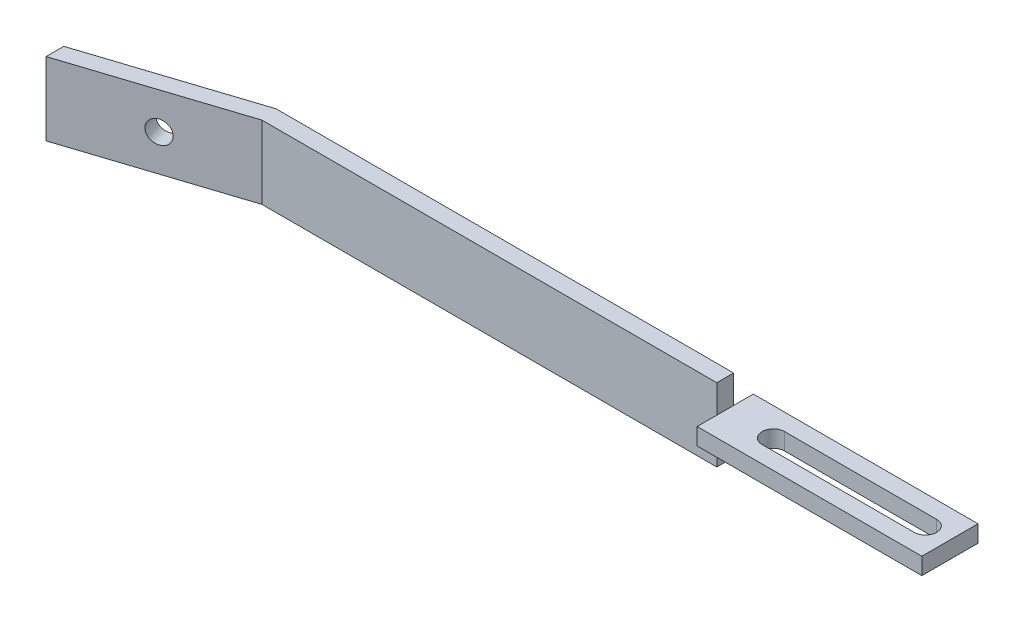
from build123d import *

# Parameters (mm, degrees)
SKETCH1_W               = 150
SKETCH1_H               = 13
BOSS_EXTRUDE1_DEPTH     = 40
CUT_EXTRUDE1_DEPTH      = 40
CUT_EXTRUDE3_DEPTH      = 86.988371307
SKETCH4_W               = 40
SKETCH4_H               = 3
BOSS_EXTRUDE2_DEPTH     = 6.5
CUT_EXTRUDE4_DEPTH      = 76.868825443
CUT_EXTRUDE4_DEPTH_BACK = 76.868825443
SKETCH5_W               = 40
SKETCH5_H               = 5
SKETCH6_W               = 40
SKETCH6_H               = 3
BOSS_EXTRUDE3_DEPTH     = 3.5
CUT_EXTRUDE6_DEPTH      = 6.5
SKETCH8_R               = 2
CUT_EXTRUDE7_DEPTH      = 6.5


with BuildPart() as part:
    # Sketch1 → Boss-Extrude1 (new body)
    with BuildSketch(Plane.XY):
        Rectangle(SKETCH1_W, SKETCH1_H)
    extrude(amount=BOSS_EXTRUDE1_DEPTH)

    # Sketch2 → Cut-Extrude1 (cut)
    with BuildSketch(Plane.XZ.offset(6.5)):
        Polygon((-75, 9.270509831), (-46.468304511, 0), (-75, 0), align=None)
    extrude(amount=-CUT_EXTRUDE1_DEPTH, mode=Mode.SUBTRACT)

    # Sketch3 → Cut-Extrude3 (cut, through all)
    with BuildSketch(Plane.XZ.offset(6.5)):
        Polygon((-75, 12.424896504), (-45.99315119, 3), (75, 3), (75, 40), (-75, 40), align=None)
    extrude(amount=-CUT_EXTRUDE3_DEPTH, mode=Mode.SUBTRACT)

    # Sketch4 → Boss-Extrude2 (add)
    with BuildSketch(Plane.XY):
        with Locations((55, 0)):
            Rectangle(SKETCH4_W, SKETCH4_H)
    extrude(amount=BOSS_EXTRUDE2_DEPTH)

    # Sketch5 → Cut-Extrude4 (cut, two sides: drawn at the far end of the back side and taken through both)
    with BuildSketch(Plane.XY.offset(3).offset(-CUT_EXTRUDE4_DEPTH_BACK)):
        with Locations((55, -4)):
            Rectangle(SKETCH5_W, SKETCH5_H)
        with Locations((55, 4)):
            Rectangle(SKETCH5_W, SKETCH5_H)
    extrude(amount=CUT_EXTRUDE4_DEPTH + CUT_EXTRUDE4_DEPTH_BACK, mode=Mode.SUBTRACT)

    # Sketch6 → Boss-Extrude3 (add)
    with BuildSketch(Plane(origin=(0, 0, 0), x_dir=(-1, 0, 0), z_dir=(0, 0, -1))):
        with Locations((-55, 0)):
            Rectangle(SKETCH6_W, SKETCH6_H)
    extrude(amount=BOSS_EXTRUDE3_DEPTH)

    # Sketch7 → Cut-Extrude6 (cut)
    with BuildSketch(Plane(origin=(0, 1.5, 0), x_dir=(1, 0, 0), z_dir=(0, 1, 0))):
        with BuildLine():
            Line((70.638691623, -3.5), (43.561509774, -3.5))
            ThreePointArc((43.561509774, -3.5), (41.561509774, -1.5), (43.561509774, 0.5))
            Line((43.561509774, 0.5), (70.638691623, 0.5))
            ThreePointArc((70.638691623, 0.5), (72.638691623, -1.5), (70.638691623, -3.5))
        make_face()
    extrude(amount=-CUT_EXTRUDE6_DEPTH, mode=Mode.SUBTRACT)

    # Sketch8 → Cut-Extrude7 (cut)
    with BuildSketch(Plane(origin=(-4.437328231, 0, -13.656692045), x_dir=(-0.9510565162951532, 0, 0.30901699437494873), z_dir=(-0.30901699437494873, 0, -0.9510565162951532))):
        with Locations((59.193983807, 0)):
            Circle(SKETCH8_R)
    extrude(amount=-CUT_EXTRUDE7_DEPTH, mode=Mode.SUBTRACT)


solid = part.part
